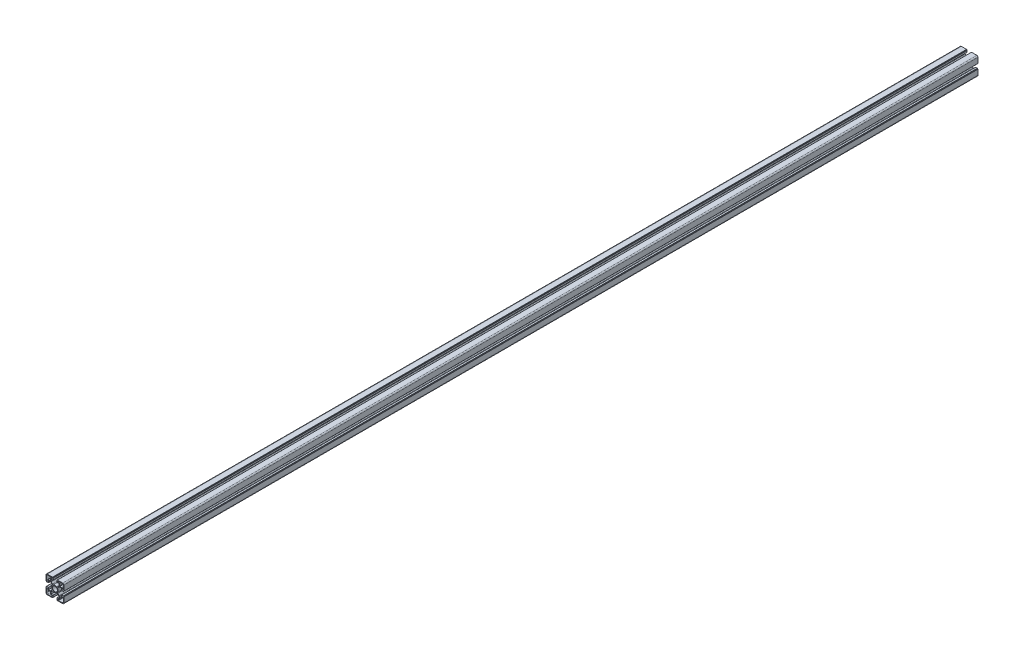
from build123d import *

# Parameters (mm, degrees)
BOSS_EXTRUDE1_DEPTH = 2303.142631306
SCALE1_SCALE        = 0.5644444


with BuildPart() as part:
    # Sketch1 → Boss-Extrude1 (new body)
    with BuildSketch(Plane.XY):
        with BuildLine():
            Line((-22.5, 19.5), (-22.5, 6.3))
            ThreePointArc((-22.5, 6.3), (-22.353553391, 5.946446609), (-22, 5.8))
            Line((-22, 5.8), (-21.3, 5.8))
            ThreePointArc((-21.3, 5.8), (-21.087867966, 5.712132034), (-21, 5.5))
            Line((-21, 5.5), (-21, 5.3))
            ThreePointArc((-21, 5.3), (-20.912132034, 5.087867966), (-20.7, 5))
            Line((-20.7, 5), (-16.7, 5))
            ThreePointArc((-16.7, 5), (-16.558578644, 5.058578644), (-16.5, 5.2))
            Line((-16.5, 5.2), (-16.5, 9.8))
            ThreePointArc((-16.5, 9.8), (-16.441421356, 9.941421356), (-16.3, 10))
            Line((-16.3, 10), (-11.864234483, 10))
            ThreePointArc((-11.864234483, 10), (-11.121828624, 9.852326293), (-10.492447327, 9.431787156))
            Line((-10.492447327, 9.431787156), (-7.296699127, 6.236038955))
            ThreePointArc((-7.296699127, 6.236038955), (-6.746669172, 5.129240469), (-6.976648919, 3.914890784))
            ThreePointArc((-6.976648919, 3.914890784), (-7.739935121, 2.023216331), (-8, 0))
            ThreePointArc((-8, 0), (-7.739935121, -2.023216331), (-6.976648919, -3.914890784))
            ThreePointArc((-6.976648919, -3.914890784), (-6.746669172, -5.129240469), (-7.296699127, -6.236038955))
            Line((-7.296699127, -6.236038955), (-10.492447327, -9.431787156))
            ThreePointArc((-10.492447327, -9.431787156), (-11.121828624, -9.852326293), (-11.864234483, -10))
            Line((-11.864234483, -10), (-16.3, -10))
            ThreePointArc((-16.3, -10), (-16.441421356, -9.941421356), (-16.5, -9.8))
            Line((-16.5, -9.8), (-16.5, -5.2))
            ThreePointArc((-16.5, -5.2), (-16.558578644, -5.058578644), (-16.7, -5))
            Line((-16.7, -5), (-20.7, -5))
            ThreePointArc((-20.7, -5), (-20.912132034, -5.087867966), (-21, -5.3))
            Line((-21, -5.3), (-21, -5.5))
            ThreePointArc((-21, -5.5), (-21.087867966, -5.712132034), (-21.3, -5.8))
            Line((-21.3, -5.8), (-22, -5.8))
            ThreePointArc((-22, -5.8), (-22.353553391, -5.946446609), (-22.5, -6.3))
            Line((-22.5, -6.3), (-22.5, -19.5))
            ThreePointArc((-22.5, -19.5), (-21.621320344, -21.621320344), (-19.5, -22.5))
            Line((-19.5, -22.5), (-6.3, -22.5))
            ThreePointArc((-6.3, -22.5), (-5.946446609, -22.353553391), (-5.8, -22))
            Line((-5.8, -22), (-5.8, -21.3))
            ThreePointArc((-5.8, -21.3), (-5.712132034, -21.087867966), (-5.5, -21))
            Line((-5.5, -21), (-5.3, -21))
            ThreePointArc((-5.3, -21), (-5.087867966, -20.912132034), (-5, -20.7))
            Line((-5, -20.7), (-5, -16.7))
            ThreePointArc((-5, -16.7), (-5.058578644, -16.558578644), (-5.2, -16.5))
            Line((-5.2, -16.5), (-9.8, -16.5))
            ThreePointArc((-9.8, -16.5), (-9.941421356, -16.441421356), (-10, -16.3))
            Line((-10, -16.3), (-10, -11.864234483))
            ThreePointArc((-10, -11.864234483), (-9.852326293, -11.121828624), (-9.431787156, -10.492447327))
            Line((-9.431787156, -10.492447327), (-6.236038955, -7.296699127))
            ThreePointArc((-6.236038955, -7.296699127), (-5.129240469, -6.746669172), (-3.914890784, -6.976648919))
            ThreePointArc((-3.914890784, -6.976648919), (-2.023216331, -7.739935121), (0, -8))
            ThreePointArc((0, -8), (2.023216331, -7.739935121), (3.914890784, -6.976648919))
            ThreePointArc((3.914890784, -6.976648919), (5.129240469, -6.746669172), (6.236038955, -7.296699127))
            Line((6.236038955, -7.296699127), (9.431787156, -10.492447327))
            ThreePointArc((9.431787156, -10.492447327), (9.852326293, -11.121828624), (10, -11.864234483))
            Line((10, -11.864234483), (10, -16.3))
            ThreePointArc((10, -16.3), (9.941421356, -16.441421356), (9.8, -16.5))
            Line((9.8, -16.5), (5.2, -16.5))
            ThreePointArc((5.2, -16.5), (5.058578644, -16.558578644), (5, -16.7))
            Line((5, -16.7), (5, -20.7))
            ThreePointArc((5, -20.7), (5.087867966, -20.912132034), (5.3, -21))
            Line((5.3, -21), (5.5, -21))
            ThreePointArc((5.5, -21), (5.712132034, -21.087867966), (5.8, -21.3))
            Line((5.8, -21.3), (5.8, -22))
            ThreePointArc((5.8, -22), (5.946446609, -22.353553391), (6.3, -22.5))
            Line((6.3, -22.5), (19.5, -22.5))
            ThreePointArc((19.5, -22.5), (21.621320344, -21.621320344), (22.5, -19.5))
            Line((22.5, -19.5), (22.5, -6.3))
            ThreePointArc((22.5, -6.3), (22.353553391, -5.946446609), (22, -5.8))
            Line((22, -5.8), (21.3, -5.8))
            ThreePointArc((21.3, -5.8), (21.087867966, -5.712132034), (21, -5.5))
            Line((21, -5.5), (21, -5.3))
            ThreePointArc((21, -5.3), (20.912132034, -5.087867966), (20.7, -5))
            Line((20.7, -5), (16.7, -5))
            ThreePointArc((16.7, -5), (16.558578644, -5.058578644), (16.5, -5.2))
            Line((16.5, -5.2), (16.5, -9.8))
            ThreePointArc((16.5, -9.8), (16.441421356, -9.941421356), (16.3, -10))
            Line((16.3, -10), (11.864234483, -10))
            ThreePointArc((11.864234483, -10), (11.121828624, -9.852326293), (10.492447327, -9.431787156))
            Line((10.492447327, -9.431787156), (7.296699127, -6.236038955))
            ThreePointArc((7.296699127, -6.236038955), (6.746669172, -5.129240469), (6.976648919, -3.914890784))
            ThreePointArc((6.976648919, -3.914890784), (7.739935121, -2.023216331), (8, 0))
            ThreePointArc((8, 0), (7.739935121, 2.023216331), (6.976648919, 3.914890784))
            ThreePointArc((6.976648919, 3.914890784), (6.746669172, 5.129240469), (7.296699127, 6.236038955))
            Line((7.296699127, 6.236038955), (10.492447327, 9.431787156))
            ThreePointArc((10.492447327, 9.431787156), (11.121828624, 9.852326293), (11.864234483, 10))
            Line((11.864234483, 10), (16.3, 10))
            ThreePointArc((16.3, 10), (16.441421356, 9.941421356), (16.5, 9.8))
            Line((16.5, 9.8), (16.5, 5.2))
            ThreePointArc((16.5, 5.2), (16.558578644, 5.058578644), (16.7, 5))
            Line((16.7, 5), (20.7, 5))
            ThreePointArc((20.7, 5), (20.912132034, 5.087867966), (21, 5.3))
            Line((21, 5.3), (21, 5.5))
            ThreePointArc((21, 5.5), (21.087867966, 5.712132034), (21.3, 5.8))
            Line((21.3, 5.8), (22, 5.8))
            ThreePointArc((22, 5.8), (22.353553391, 5.946446609), (22.5, 6.3))
            Line((22.5, 6.3), (22.5, 19.5))
            ThreePointArc((22.5, 19.5), (21.621320344, 21.621320344), (19.5, 22.5))
            Line((19.5, 22.5), (6.3, 22.5))
            ThreePointArc((6.3, 22.5), (5.946446609, 22.353553391), (5.8, 22))
            Line((5.8, 22), (5.8, 21.3))
            ThreePointArc((5.8, 21.3), (5.712132034, 21.087867966), (5.5, 21))
            Line((5.5, 21), (5.3, 21))
            ThreePointArc((5.3, 21), (5.087867966, 20.912132034), (5, 20.7))
            Line((5, 20.7), (5, 16.7))
            ThreePointArc((5, 16.7), (5.058578644, 16.558578644), (5.2, 16.5))
            Line((5.2, 16.5), (9.8, 16.5))
            ThreePointArc((9.8, 16.5), (9.941421356, 16.441421356), (10, 16.3))
            Line((10, 16.3), (10, 11.864234483))
            ThreePointArc((10, 11.864234483), (9.852326293, 11.121828624), (9.431787156, 10.492447327))
            Line((9.431787156, 10.492447327), (6.236038955, 7.296699127))
            ThreePointArc((6.236038955, 7.296699127), (5.129240469, 6.746669172), (3.914890784, 6.976648919))
            ThreePointArc((3.914890784, 6.976648919), (2.023216331, 7.739935121), (0, 8))
            ThreePointArc((0, 8), (-2.023216331, 7.739935121), (-3.914890784, 6.976648919))
            ThreePointArc((-3.914890784, 6.976648919), (-5.129240469, 6.746669172), (-6.236038955, 7.296699127))
            Line((-6.236038955, 7.296699127), (-9.431787156, 10.492447327))
            ThreePointArc((-9.431787156, 10.492447327), (-9.852326293, 11.121828624), (-10, 11.864234483))
            Line((-10, 11.864234483), (-10, 16.3))
            ThreePointArc((-10, 16.3), (-9.941421356, 16.441421356), (-9.8, 16.5))
            Line((-9.8, 16.5), (-5.2, 16.5))
            ThreePointArc((-5.2, 16.5), (-5.058578644, 16.558578644), (-5, 16.7))
            Line((-5, 16.7), (-5, 20.7))
            ThreePointArc((-5, 20.7), (-5.087867966, 20.912132034), (-5.3, 21))
            Line((-5.3, 21), (-5.5, 21))
            ThreePointArc((-5.5, 21), (-5.712132034, 21.087867966), (-5.8, 21.3))
            Line((-5.8, 21.3), (-5.8, 22))
            ThreePointArc((-5.8, 22), (-5.946446609, 22.353553391), (-6.3, 22.5))
            Line((-6.3, 22.5), (-19.5, 22.5))
            ThreePointArc((-19.5, 22.5), (-21.621320344, 21.621320344), (-22.5, 19.5))
        make_face()
        with BuildLine():
            Line((-21, 18.5), (-21, 9))
            ThreePointArc((-21, 9), (-19.5, 7.5), (-18, 9))
            Line((-18, 9), (-18, 10.5))
            ThreePointArc((-18, 10.5), (-17.707106781, 11.207106781), (-17, 11.5))
            Line((-17, 11.5), (-12.5, 11.5))
            ThreePointArc((-12.5, 11.5), (-11.792893219, 11.792893219), (-11.5, 12.5))
            Line((-11.5, 12.5), (-11.5, 17))
            ThreePointArc((-11.5, 17), (-11.207106781, 17.707106781), (-10.5, 18))
            Line((-10.5, 18), (-9, 18))
            ThreePointArc((-9, 18), (-7.5, 19.5), (-9, 21))
            Line((-9, 21), (-18.5, 21))
            ThreePointArc((-18.5, 21), (-20.267766953, 20.267766953), (-21, 18.5))
        make_face(mode=Mode.SUBTRACT)
        with BuildLine():
            Line((18.5, 21), (9, 21))
            ThreePointArc((9, 21), (7.5, 19.5), (9, 18))
            Line((9, 18), (10.5, 18))
            ThreePointArc((10.5, 18), (11.207106781, 17.707106781), (11.5, 17))
            Line((11.5, 17), (11.5, 12.5))
            ThreePointArc((11.5, 12.5), (11.792893219, 11.792893219), (12.5, 11.5))
            Line((12.5, 11.5), (17, 11.5))
            ThreePointArc((17, 11.5), (17.707106781, 11.207106781), (18, 10.5))
            Line((18, 10.5), (18, 9))
            ThreePointArc((18, 9), (19.5, 7.5), (21, 9))
            Line((21, 9), (21, 18.5))
            ThreePointArc((21, 18.5), (20.267766953, 20.267766953), (18.5, 21))
        make_face(mode=Mode.SUBTRACT)
        with BuildLine():
            Line((21, -18.5), (21, -9))
            ThreePointArc((21, -9), (19.5, -7.5), (18, -9))
            Line((18, -9), (18, -10.5))
            ThreePointArc((18, -10.5), (17.707106781, -11.207106781), (17, -11.5))
            Line((17, -11.5), (12.5, -11.5))
            ThreePointArc((12.5, -11.5), (11.792893219, -11.792893219), (11.5, -12.5))
            Line((11.5, -12.5), (11.5, -17))
            ThreePointArc((11.5, -17), (11.207106781, -17.707106781), (10.5, -18))
            Line((10.5, -18), (9, -18))
            ThreePointArc((9, -18), (7.5, -19.5), (9, -21))
            Line((9, -21), (18.5, -21))
            ThreePointArc((18.5, -21), (20.267766953, -20.267766953), (21, -18.5))
        make_face(mode=Mode.SUBTRACT)
        with BuildLine():
            Line((-18.5, -21), (-9, -21))
            ThreePointArc((-9, -21), (-7.5, -19.5), (-9, -18))
            Line((-9, -18), (-10.5, -18))
            ThreePointArc((-10.5, -18), (-11.207106781, -17.707106781), (-11.5, -17))
            Line((-11.5, -17), (-11.5, -12.5))
            ThreePointArc((-11.5, -12.5), (-11.792893219, -11.792893219), (-12.5, -11.5))
            Line((-12.5, -11.5), (-17, -11.5))
            ThreePointArc((-17, -11.5), (-17.707106781, -11.207106781), (-18, -10.5))
            Line((-18, -10.5), (-18, -9))
            ThreePointArc((-18, -9), (-19.5, -7.5), (-21, -9))
            Line((-21, -9), (-21, -18.5))
            ThreePointArc((-21, -18.5), (-20.267766953, -20.267766953), (-18.5, -21))
        make_face(mode=Mode.SUBTRACT)
        with BuildLine():
            ThreePointArc((0, 6.1), (-4.313351365, 4.313351365), (-6.1, 0))
            ThreePointArc((-6.1, 0), (-4.313351365, -4.313351365), (0, -6.1))
            ThreePointArc((0, -6.1), (4.313351365, -4.313351365), (6.1, 0))
            ThreePointArc((6.1, 0), (4.313351365, 4.313351365), (0, 6.1))
        make_face(mode=Mode.SUBTRACT)
    extrude(amount=BOSS_EXTRUDE1_DEPTH)


with BuildPart() as part_1:
    # Scale1: scaled about (0, 0, 1151.571315653)
    add(part.part.scale(SCALE1_SCALE).moved(Location((0, 0, 501.573335332))))


solid = part_1.part
